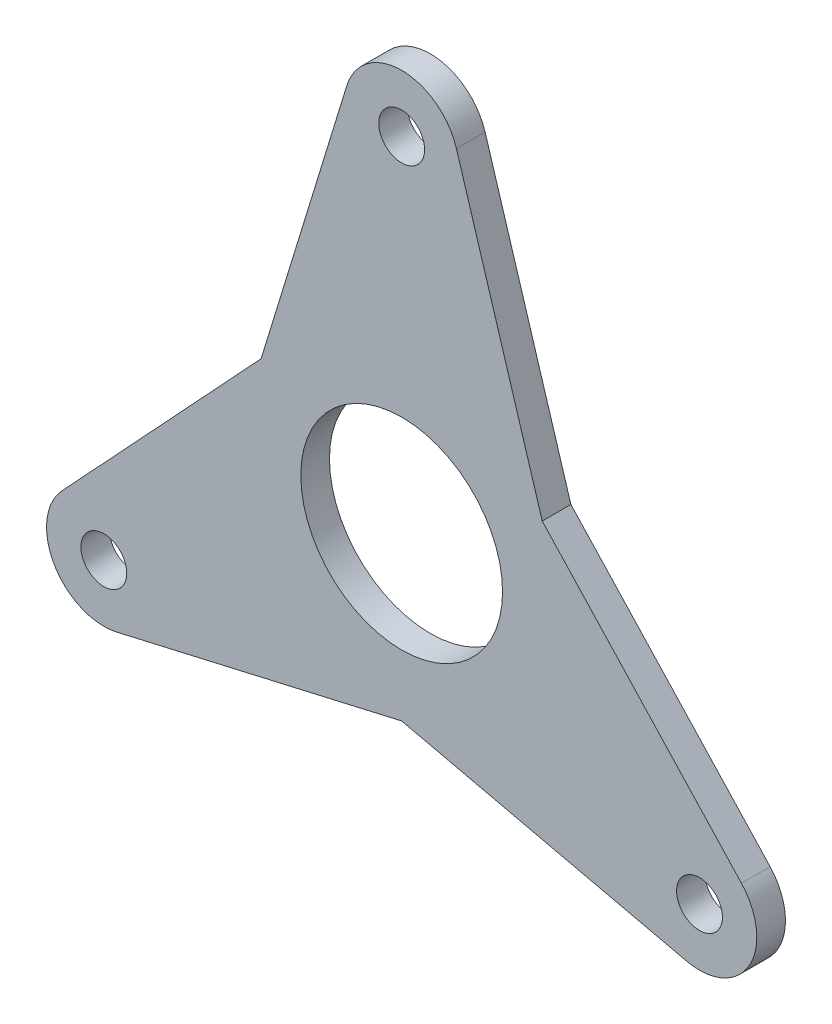
from build123d import *

# Parameters (mm, degrees)
SKETCH3_R           = 11.176
SKETCH3_R_2         = 2.54
BOSS_EXTRUDE2_DEPTH = 3.175


with BuildPart() as part:
    # Sketch3 → Boss-Extrude2 (new body)
    with BuildSketch(Plane.XY):
        with BuildLine():
            Line((-6.070664946, 39.962666667), (-15.573595811, 8.991419734))
            Line((-15.573595811, 8.991419734), (-37.644017009, -14.723983272))
            ThreePointArc((-37.644017009, -14.723983272), (-38.494829198, -22.225), (-31.573352063, -25.238683395))
            Line((-31.573352063, -25.238683395), (0, -17.982839467))
            Line((0, -17.982839467), (31.573352063, -25.238683395))
            ThreePointArc((31.573352063, -25.238683395), (38.494829198, -22.225), (37.644017009, -14.723983272))
            Line((37.644017009, -14.723983272), (15.573595811, 8.991419734))
            Line((15.573595811, 8.991419734), (6.070664946, 39.962666667))
            ThreePointArc((6.070664946, 39.962666667), (0, 44.45), (-6.070664946, 39.962666667))
        make_face()
        Circle(SKETCH3_R, mode=Mode.SUBTRACT)
        with Locations((0, 38.1)):
            Circle(SKETCH3_R_2, mode=Mode.SUBTRACT)
        with Locations((32.995567884, -19.05)):
            Circle(SKETCH3_R_2, mode=Mode.SUBTRACT)
        with Locations((-32.995567884, -19.05)):
            Circle(SKETCH3_R_2, mode=Mode.SUBTRACT)
    extrude(amount=BOSS_EXTRUDE2_DEPTH)


solid = part.part
